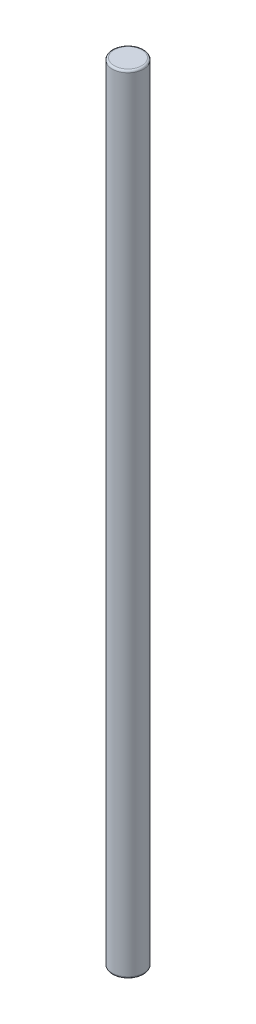
from build123d import *

# Parameters (mm, degrees)
SKETCH1_R           = 2
BOSS_EXTRUDE1_DEPTH = 100
FILLET1_R           = 0.25


with BuildPart() as part:
    # Sketch1 → Boss-Extrude1 (new body)
    with BuildSketch(Plane(origin=(0, 0, 0), x_dir=(1, 0, 0), z_dir=(0, 1, 0))):
        with Locations(Location((0, 0, 0), (0, 0, 270))):
            Circle(SKETCH1_R)
    extrude(amount=BOSS_EXTRUDE1_DEPTH)

    # Fillet1
    fillet1_edges = [part.edges().sort_by_distance(p)[0] for p in [
        (0, 0, -2),
        (0, 100, -2),
    ]]
    fillet(fillet1_edges, radius=FILLET1_R)


solid = part.part
